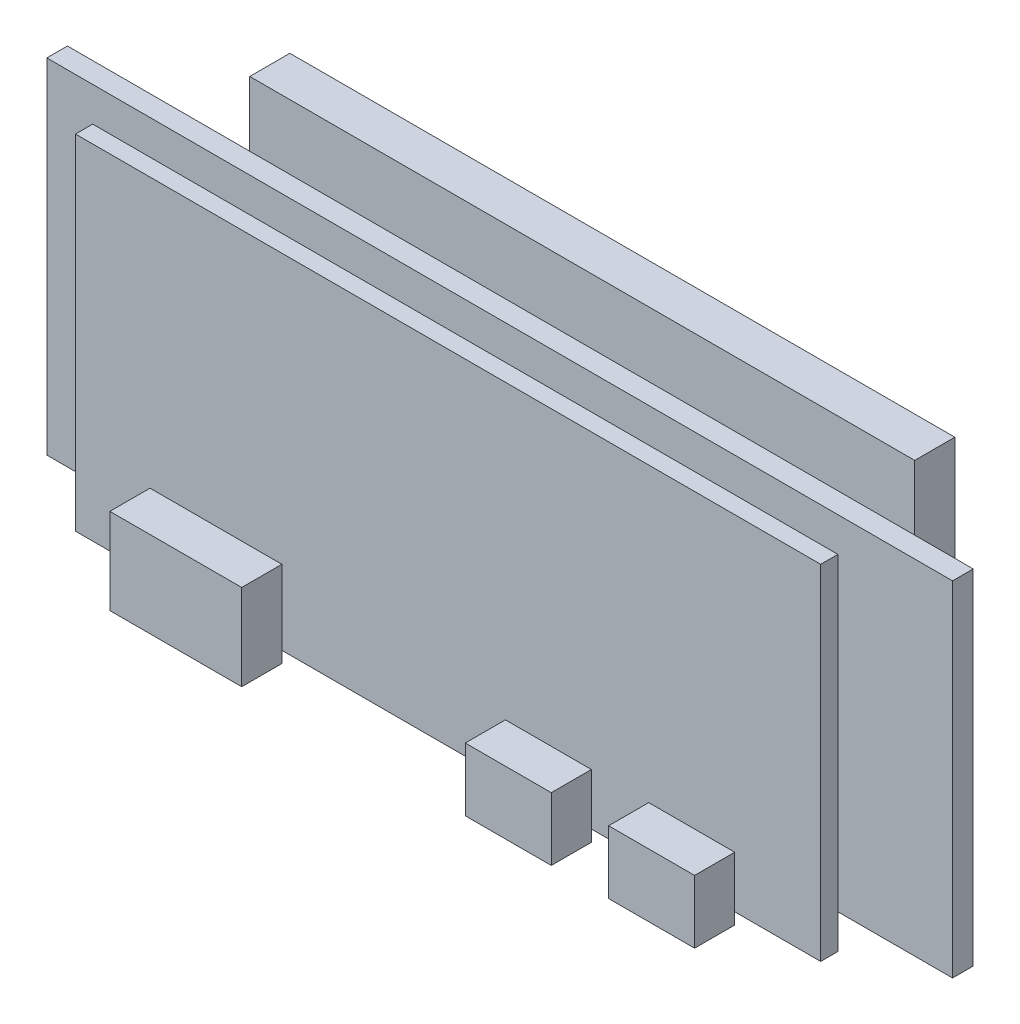
from build123d import *

# Parameters (mm, degrees)
SKETCH1_W           = 58
SKETCH1_H           = 30.5
BOSS_EXTRUDE1_DEPTH = 3.5
SKETCH2_R           = 5.077771543
BOSS_EXTRUDE2_DEPTH = 5.9
SKETCH3_W           = 79
SKETCH3_H           = 30
BOSS_EXTRUDE3_DEPTH = 1.8
SKETCH4_R           = 7.569009477
BOSS_EXTRUDE4_DEPTH = 2.5
SKETCH5_W           = 65
SKETCH5_H           = 30
BOSS_EXTRUDE5_DEPTH = 1.5
SKETCH6_W           = 11.5
SKETCH6_H           = 7.5
SKETCH6_W_2         = 7.5
SKETCH6_H_2         = 5.5
BOSS_EXTRUDE6_DEPTH = 3.5


with BuildPart() as part:
    # Sketch1 → Boss-Extrude1 (new body)
    with BuildSketch(Plane.XY):
        Rectangle(SKETCH1_W, SKETCH1_H)
    extrude(amount=BOSS_EXTRUDE1_DEPTH)

    # Sketch2 → Boss-Extrude2 (add)
    with BuildSketch(Plane.XY.offset(3.5)):
        Circle(SKETCH2_R)
    extrude(amount=BOSS_EXTRUDE2_DEPTH)

    # Sketch3 → Boss-Extrude3 (add)
    with BuildSketch(Plane.XY.offset(9.4)):
        with Locations((0.5, 0.5)):
            Rectangle(SKETCH3_W, SKETCH3_H)
    extrude(amount=BOSS_EXTRUDE3_DEPTH)

    # Sketch4 → Boss-Extrude4 (add)
    with BuildSketch(Plane(origin=(0, 0, 11.2), x_dir=(-1, 0, 0), z_dir=(0, 0, -1))):
        Circle(SKETCH4_R)
    extrude(amount=-BOSS_EXTRUDE4_DEPTH)

    # Sketch5 → Boss-Extrude5 (add)
    with BuildSketch(Plane(origin=(0, 0, 13.7), x_dir=(-1, 0, 0), z_dir=(0, 0, -1))):
        Rectangle(SKETCH5_W, SKETCH5_H)
    extrude(amount=-BOSS_EXTRUDE5_DEPTH)

    # Sketch6 → Boss-Extrude6 (add)
    with BuildSketch(Plane.XY.offset(15.2)):
        with Locations((-20.25, -12.25)):
            Rectangle(SKETCH6_W, SKETCH6_H)
        with Locations((21.25, -13.25)):
            Rectangle(SKETCH6_W_2, SKETCH6_H_2)
        with Locations((8.75, -13.25)):
            Rectangle(SKETCH6_W_2, SKETCH6_H_2)
    extrude(amount=BOSS_EXTRUDE6_DEPTH)


solid = part.part
